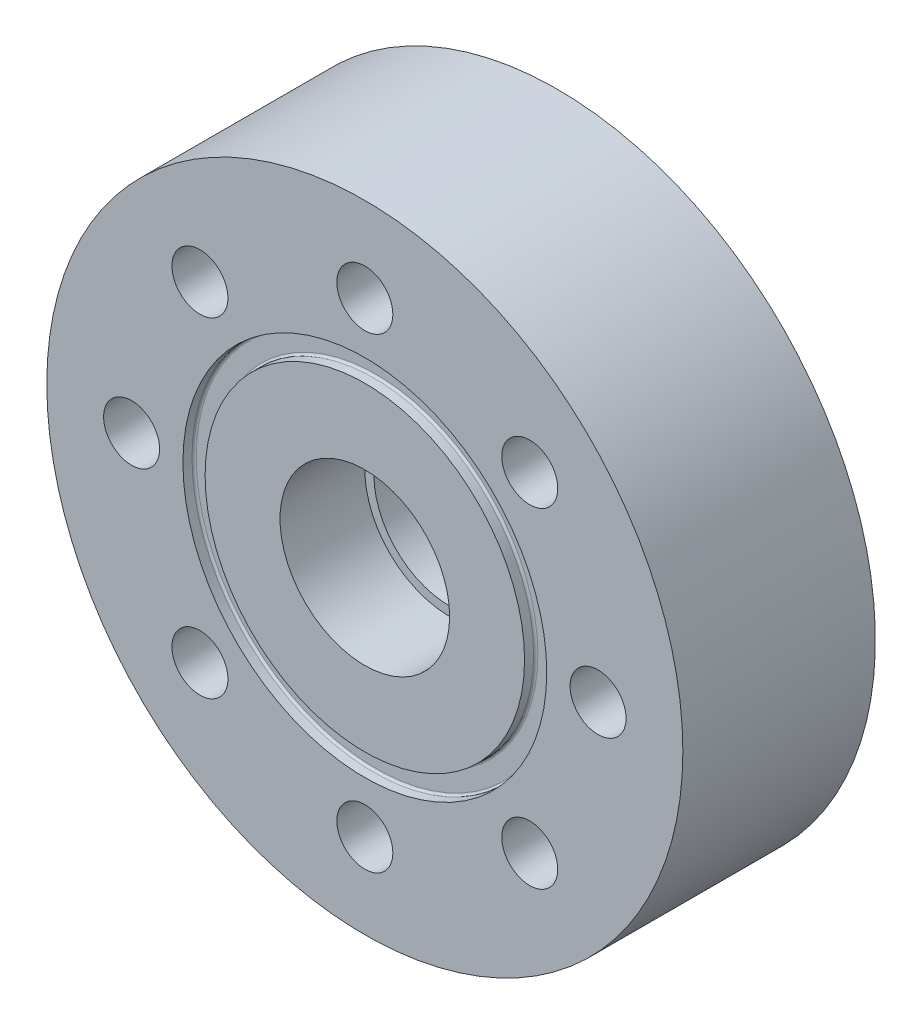
from build123d import *

# Parameters (mm, degrees)
SKETCH2_R           = 37.5
SKETCH2_R_2         = 10
BOSS_EXTRUDE1_DEPTH = 10
BOSS_EXTRUDE2_START = 12.7
SKETCH7_R           = 37.5
BOSS_EXTRUDE2_DEPTH = 12.7
SKETCH8_R           = 3.302
CUT_EXTRUDE2_DEPTH  = 58.687000269
SKETCH9_R           = 8.9296875
CUT_EXTRUDE3_DEPTH  = 12.7
SKETCH11_R          = 21.45
SKETCH11_R_2        = 18.8338
CUT_EXTRUDE5_DEPTH  = 1.3208
FILLET1_R           = 0.254


with BuildPart() as part:
    # Sketch2 → Boss-Extrude1 (new body)
    with BuildSketch(Plane.XY):
        Circle(SKETCH2_R)
        Circle(SKETCH2_R_2, mode=Mode.SUBTRACT)
    extrude(amount=BOSS_EXTRUDE1_DEPTH)

    # Sketch7 → Boss-Extrude2 (add)
    with BuildSketch(Plane(origin=(0, 0, 0), x_dir=(-1, 0, 0), z_dir=(0, 0, -1)).offset(BOSS_EXTRUDE2_START)):
        Circle(SKETCH7_R)
    extrude(amount=-BOSS_EXTRUDE2_DEPTH)

    # Sketch8 → Cut-Extrude2 (cut, through all)
    with BuildSketch(Plane.XY.offset(10)):
        with Locations((0, 27.5)):
            Circle(SKETCH8_R)
        with Locations((19.445436483, 19.445436483)):
            Circle(SKETCH8_R)
        with Locations((27.5, 0)):
            Circle(SKETCH8_R)
        with Locations((19.445436483, -19.445436483)):
            Circle(SKETCH8_R)
        with Locations((0, -27.5)):
            Circle(SKETCH8_R)
        with Locations((-19.445436483, -19.445436483)):
            Circle(SKETCH8_R)
        with Locations((-27.5, 0)):
            Circle(SKETCH8_R)
        with Locations((-19.445436483, 19.445436483)):
            Circle(SKETCH8_R)
    extrude(amount=-CUT_EXTRUDE2_DEPTH, mode=Mode.SUBTRACT)

    # Sketch9 → Cut-Extrude3 (cut)
    with BuildSketch(Plane(origin=(0, 0, -12.7), x_dir=(-1, 0, 0), z_dir=(0, 0, -1))):
        Circle(SKETCH9_R)
    extrude(amount=-CUT_EXTRUDE3_DEPTH, mode=Mode.SUBTRACT)

    # Sketch11 → Cut-Extrude5 (cut)
    with BuildSketch(Plane.XY.offset(10)):
        Circle(SKETCH11_R)
        Circle(SKETCH11_R_2, mode=Mode.SUBTRACT)
    extrude(amount=-CUT_EXTRUDE5_DEPTH, mode=Mode.SUBTRACT)

    # Fillet1
    fillet1_edges = [part.edges().sort_by_distance(p)[0] for p in [
        (-21.45, 0, 8.6792),
        (-18.8338, 0, 8.6792),
    ]]
    fillet(fillet1_edges, radius=FILLET1_R)


solid = part.part
